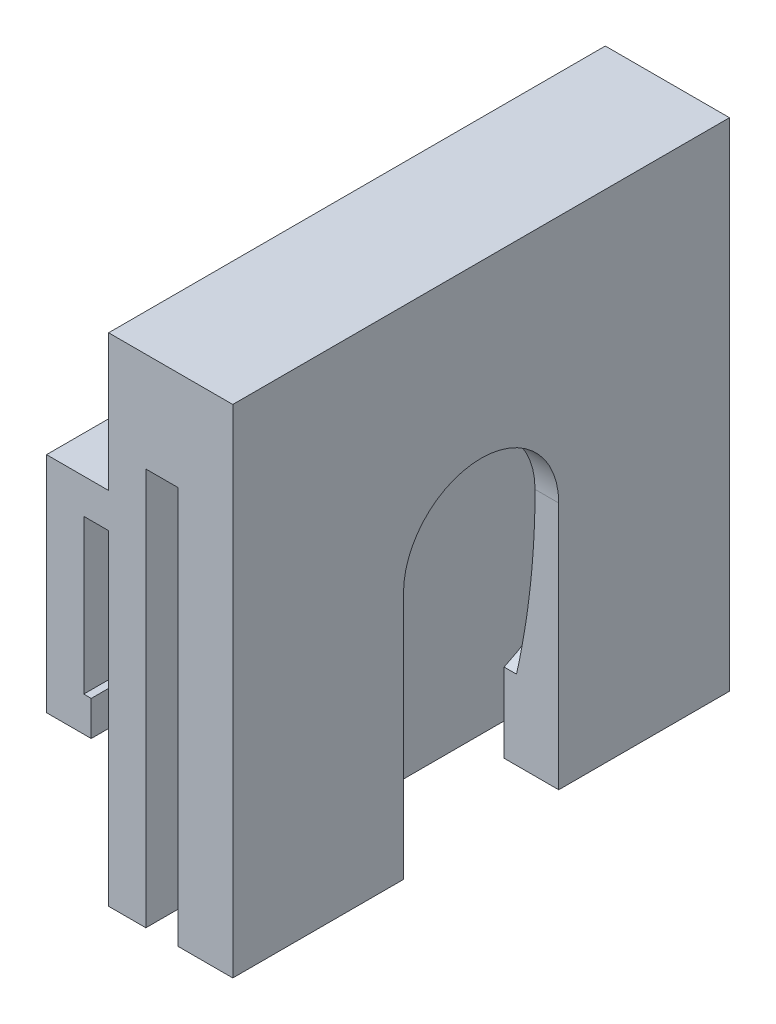
from build123d import *
from build123d.topology import SkipClean

# Parameters (mm, degrees)
SKETCH1_W           = 4
SKETCH1_H           = 9
BOSS_EXTRUDE1_DEPTH = 20
SKETCH2_W           = 1
SKETCH2_H           = 6
CUT_EXTRUDE1_DEPTH  = 21.597329924
SKETCH4_W           = 20
SKETCH4_H           = 20
BOSS_EXTRUDE2_DEPTH = 1.5
SKETCH5_W           = 20
SKETCH5_H           = 20
BOSS_EXTRUDE3_DEPTH = 3.5
SKETCH7_W           = 1.8
SKETCH7_H           = 20
CUT_EXTRUDE5_DEPTH  = 16
CUT_EXTRUDE6_START  = -1.7
CUT_EXTRUDE6_DEPTH  = 1.7
BOSS_EXTRUDE4_START = 0.5
BOSS_EXTRUDE4_DEPTH = 0.5
SKETCH10_W          = 0.7
SKETCH10_H          = 1.5
CUT_EXTRUDE7_DEPTH  = 24.027157903
SKETCH11_W          = 1
SKETCH11_H          = 6.2
CUT_EXTRUDE8_DEPTH  = 24.027157903


with BuildPart() as part:
    # Sketch1 → Boss-Extrude1 (new body)
    with BuildSketch(Plane.XY):
        Rectangle(SKETCH1_W, SKETCH1_H)
    extrude(amount=BOSS_EXTRUDE1_DEPTH)

    # Sketch2 → Cut-Extrude1 (cut, through all)
    with BuildSketch(Plane(origin=(0, 0, 0), x_dir=(-1, 0, 0), z_dir=(0, 0, -1))):
        Rectangle(SKETCH2_W, SKETCH2_H)
    extrude(amount=-CUT_EXTRUDE1_DEPTH, mode=Mode.SUBTRACT)

    # Sketch4 → Boss-Extrude2 (add)
    with BuildSketch(Plane(origin=(2, 0, 0), x_dir=(0, 0, -1), z_dir=(1, 0, 0))):
        with Locations((-10, 0)):
            Rectangle(SKETCH4_W, SKETCH4_H)
    extrude(amount=-BOSS_EXTRUDE2_DEPTH)

    # Sketch5 → Boss-Extrude3 (add)
    with BuildSketch(Plane(origin=(2, 0, 0), x_dir=(0, 0, -1), z_dir=(1, 0, 0))):
        with Locations((-10, 0)):
            Rectangle(SKETCH5_W, SKETCH5_H)
    extrude(amount=BOSS_EXTRUDE3_DEPTH)

    # Sketch6 → Cut-Revolve2 (revolve, cut)
    with BuildSketch(Plane(origin=(0, 0, 10), x_dir=(-1, 0, 0), z_dir=(0, 0, -1)), mode=Mode.PRIVATE) as cut_revolve2_sk:
        with BuildLine():
            Line((-2, 7.5), (-2, 0))
            Line((-2, 0), (-4.700284, 0))
            ThreePointArc((-4.700284, 0), (-4.474408022, 3.776920415), (-3.8, 7.5))
            Line((-3.8, 7.5), (-2, 7.5))
        make_face()
    revolve(cut_revolve2_sk.sketch.rotate(Axis((88.99, 0, 10), (-1, 0, 0)), 90), axis=Axis((88.99, 0, 10), (-1, 0, 0)), mode=Mode.SUBTRACT)

    # Sketch7 → Cut-Extrude5 (cut)
    with BuildSketch(Plane.XZ.offset(10)):
        with Locations((2.9, 10)):
            Rectangle(SKETCH7_W, SKETCH7_H)
    extrude(amount=-CUT_EXTRUDE5_DEPTH, mode=Mode.SUBTRACT)

    # Sketch8 → Cut-Extrude6 (cut)
    with BuildSketch(Plane(origin=(5.5, 0, 0), x_dir=(0, 0, -1), z_dir=(1, 0, 0)).offset(CUT_EXTRUDE6_START)):
        with BuildLine():
            Line((-6.875, 0), (-6.875, -10))
            ThreePointArc((-6.875, -10), (-10, -13.125), (-13.125, -10))
            Line((-13.125, -10), (-13.125, 0))
            ThreePointArc((-13.125, 0), (-10, 3.125), (-6.875, 0))
        make_face()
    extrude(amount=CUT_EXTRUDE6_DEPTH, mode=Mode.SUBTRACT)

    # Sketch9 → Boss-Extrude4 (add)
    with SkipClean():  # the faces are left unmerged after this step: merging them gives an invalid solid
        with BuildSketch(Plane.ZY.offset(-3.8).offset(BOSS_EXTRUDE4_START)):
            with BuildLine():
                Line((13.125, -6.817945072), (13.125, -10))
                Line((13.125, -10), (20, -10))
                Line((20, -10), (20, 6))
                Line((20, 6), (14.5, 6))
                ThreePointArc((14.5, 6), (17.457216989, -0.799946739), (13.125, -6.817945072))
            make_face()
            with BuildLine():
                Line((0, -10), (6.875, -10))
                Line((6.875, -10), (6.875, -6.817945072))
                ThreePointArc((6.875, -6.817945072), (2.542783011, -0.799946739), (5.5, 6))
                Line((5.5, 6), (0, 6))
                Line((0, 6), (0, -10))
            make_face()
        extrude(amount=-BOSS_EXTRUDE4_DEPTH)

    # Sketch10 → Cut-Extrude7 (cut, through all)
    with SkipClean():  # the faces are left unmerged after this step: merging them gives an invalid solid
        with BuildSketch(Plane.XY.offset(20)):
            with Locations((0.15, -3.75)):
                Rectangle(SKETCH10_W, SKETCH10_H)
        extrude(amount=-CUT_EXTRUDE7_DEPTH, mode=Mode.SUBTRACT)

    # Sketch11 → Cut-Extrude8 (cut, through all)
    with SkipClean():  # the faces are left unmerged after this step: merging them gives an invalid solid
        with BuildSketch(Plane.XY.offset(20)):
            Rectangle(SKETCH11_W, SKETCH11_H)
        extrude(amount=-CUT_EXTRUDE8_DEPTH, mode=Mode.SUBTRACT)


solid = part.part
